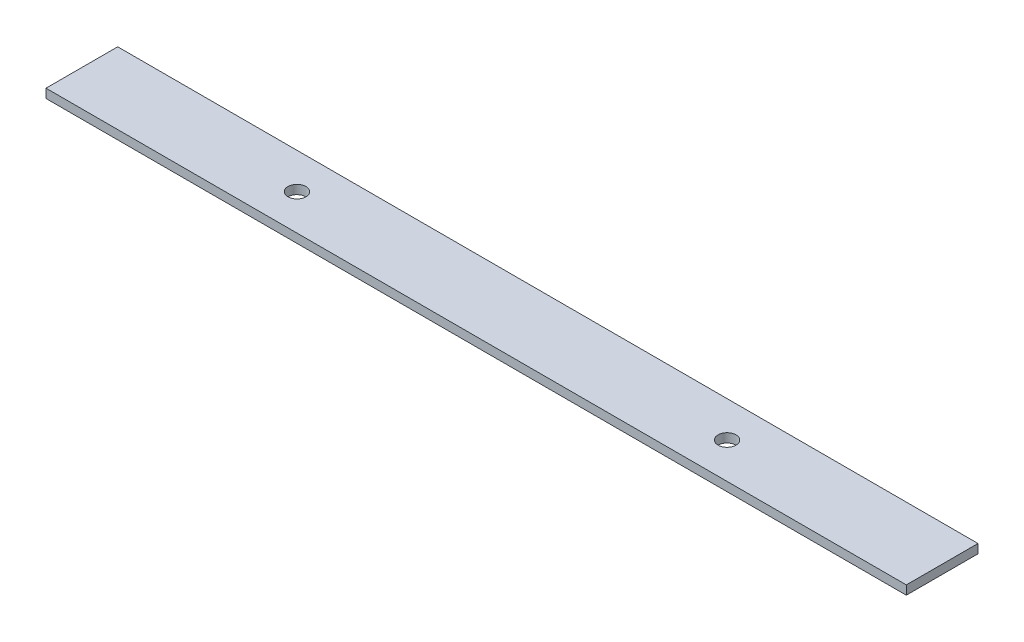
from build123d import *

# Parameters (mm, degrees)
SKETCH1_W           = 304.8
SKETCH1_H           = 25.4
BOSS_EXTRUDE1_DEPTH = 3.175
SKETCH2_R           = 3.175
CUT_EXTRUDE1_DEPTH  = 3.175


with BuildPart() as part:
    # Sketch1 → Boss-Extrude1 (new body)
    with BuildSketch(Plane(origin=(0, 0, 0), x_dir=(1, 0, 0), z_dir=(0, 1, 0))):
        with Locations((152.4, -12.7)):
            Rectangle(SKETCH1_W, SKETCH1_H)
    extrude(amount=BOSS_EXTRUDE1_DEPTH)

    # Sketch2 → Cut-Extrude1 (cut)
    with BuildSketch(Plane(origin=(0, 3.175, 0), x_dir=(1, 0, 0), z_dir=(0, 1, 0))):
        with Locations(Location((76.2, -12.7, 0), (0, 0, 270))):
            Circle(SKETCH2_R)
        with Locations(Location((228.6, -12.7, 0), (0, 0, 270))):
            Circle(SKETCH2_R)
    extrude(amount=-CUT_EXTRUDE1_DEPTH, mode=Mode.SUBTRACT)


solid = part.part
